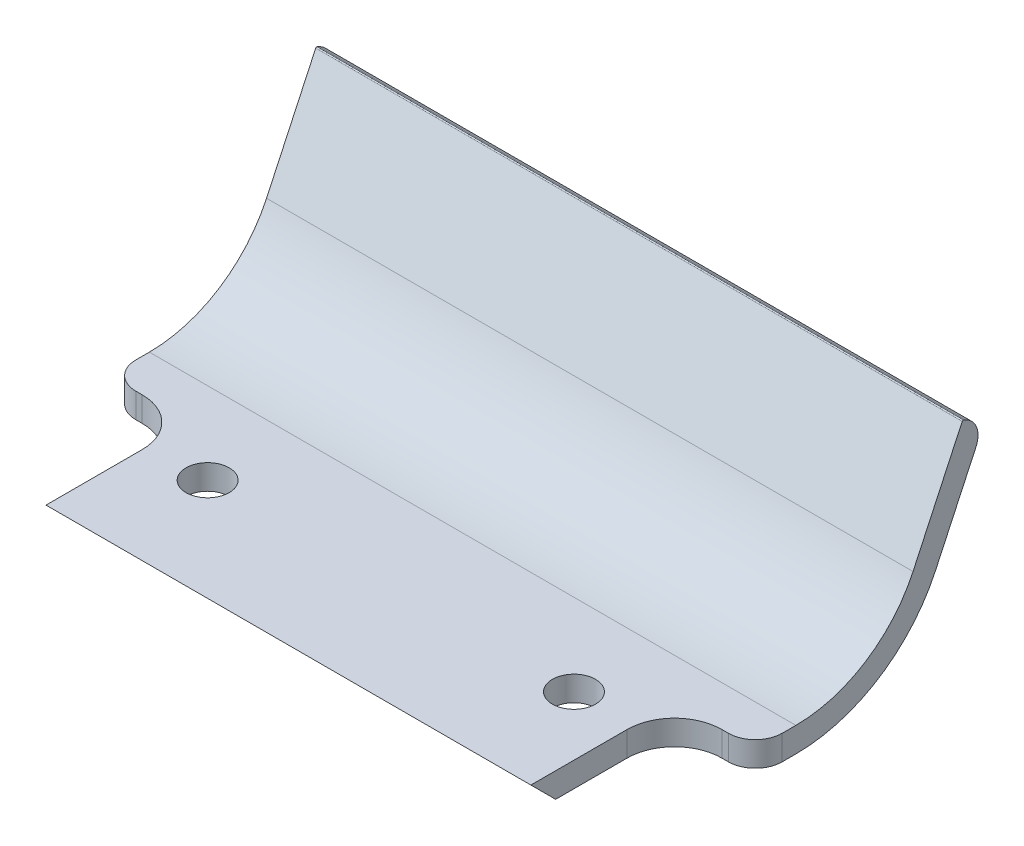
from build123d import *

# Parameters (mm, degrees)
BOSS_EXTRUDE1_DEPTH = 30
SKETCH3_R           = 2
CUT_EXTRUDE1_DEPTH  = 49.344936653
FILLET1_R           = 2.5


with BuildPart() as part:
    # Sketch2 → Boss-Extrude1 (new, symmetric)
    with BuildSketch(Plane(origin=(0, 0, 0), x_dir=(0, 0, -1), z_dir=(1, 0, 0))):
        with BuildLine():
            Line((0, 0), (17.093183557, 0))
            ThreePointArc((17.093183557, 0), (23.540778857, 1.87930265), (27.968877001, 6.928580859))
            Line((27.968877001, 6.928580859), (32.531082361, 16.712261826))
            ThreePointArc((32.531082361, 16.712261826), (32.587511126, 16.763969262), (32.663974966, 16.760630779))
            Line((32.663974966, 16.760630779), (32.845236523, 16.676107126))
            ThreePointArc((32.845236523, 16.676107126), (33.879385242, 15.547531839), (33.812615574, 14.018255029))
            Line((33.812615574, 14.018255029), (30.053384911, 5.956558857))
            ThreePointArc((30.053384911, 5.956558857), (24.776567956, -0.060497675), (17.093183557, -2.3))
            Line((17.093183557, -2.3), (2.3, -2.3))
            Line((2.3, -2.3), (0, 0))
        make_face()
    extrude(amount=BOSS_EXTRUDE1_DEPTH, both=True)

    # Sketch3 → Cut-Extrude1 (cut, through all)
    with BuildSketch(Plane(origin=(0, 0, 0), x_dir=(1, 0, 0), z_dir=(0, 1, 0))):
        with BuildLine():
            Line((-26.9, 13.33), (-30, 13.33))
            Line((-30, 13.33), (-30, 0))
            Line((-30, 0), (-22.5, 0))
            Line((-22.5, 0), (-22.5, 8.93))
            ThreePointArc((-22.5, 8.93), (-23.788730163, 12.041269837), (-26.9, 13.33))
        make_face()
        with Locations(Location((-17, 9.5, 0), (0, 0, 270))):
            Circle(SKETCH3_R)
        with Locations(Location((17, 9.5, 0), (0, 0, 270))):
            Circle(SKETCH3_R)
        with BuildLine():
            Line((30, 0), (30, 13.33))
            Line((30, 13.33), (26.9, 13.33))
            ThreePointArc((26.9, 13.33), (23.788730163, 12.041269837), (22.5, 8.93))
            Line((22.5, 8.93), (22.5, 0))
            Line((22.5, 0), (30, 0))
        make_face()
    extrude(amount=-CUT_EXTRUDE1_DEPTH, mode=Mode.SUBTRACT)

    # Fillet1
    fillet1_edges = [part.edges().sort_by_distance(p)[0] for p in [
        (-30, -1.15, -13.33),
        (30, -1.15, -13.33),
    ]]
    fillet(fillet1_edges, radius=FILLET1_R)


solid = part.part
